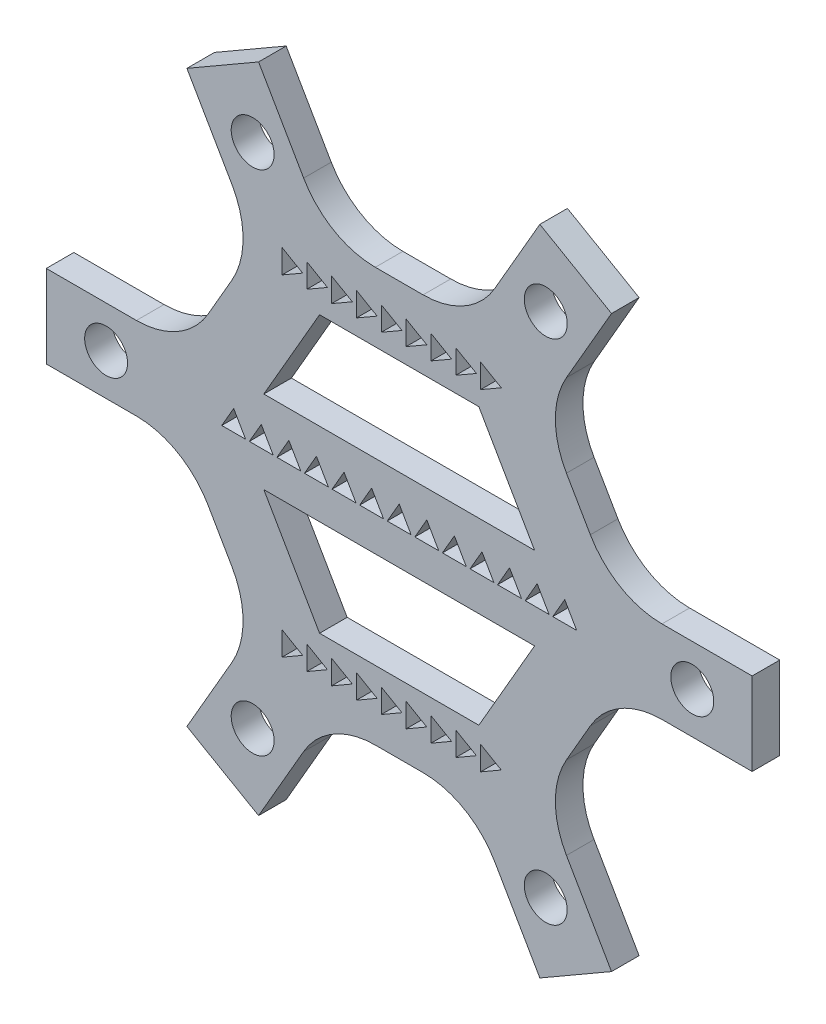
from build123d import *

# Parameters (mm, degrees)
BOSS_EXTRUDE2_DEPTH = 10
SKETCH2_R           = 8
CUT_EXTRUDE1_DEPTH  = 17
CUT_EXTRUDE2_DEPTH  = 20
SKETCH4_R           = 8
SKETCH4_R_2         = 2.8
BOSS_EXTRUDE3_DEPTH = 10
SKETCH5_R           = 7.78
CUT_EXTRUDE3_DEPTH  = 19


with BuildPart() as part:
    # Sketch1 → Boss-Extrude2 (new body)
    # profile 1 of 2: a face of its own
    with BuildSketch(Plane.XY):
        with BuildLine():
            ThreePointArc((-60.621778265, 45), (-56.602540378, 60), (-60.621778265, 75))
            Line((-60.621778265, 75), (-76.961524227, 103.301270189))
            Line((-76.961524227, 103.301270189), (-50.980762114, 118.301270189))
            Line((-50.980762114, 118.301270189), (-34.641016151, 90))
            ThreePointArc((-34.641016151, 90), (-23.660254038, 79.019237886), (-8.660254038, 75))
            Line((-8.660254038, 75), (8.660254038, 75))
            ThreePointArc((8.660254038, 75), (23.660254038, 79.019237886), (34.641016151, 90))
            Line((34.641016151, 90), (50.980762114, 118.301270189))
            Line((50.980762114, 118.301270189), (76.961524227, 103.301270189))
            Line((76.961524227, 103.301270189), (60.621778265, 75))
            ThreePointArc((60.621778265, 75), (56.602540378, 60), (60.621778265, 45))
            Line((60.621778265, 45), (69.282032303, 30))
            ThreePointArc((69.282032303, 30), (80.262794416, 19.019237886), (95.262794416, 15))
            Line((95.262794416, 15), (127.942286341, 15))
            Line((127.942286341, 15), (127.942286341, -15))
            Line((127.942286341, -15), (95.262794416, -15))
            ThreePointArc((95.262794416, -15), (80.262794416, -19.019237886), (69.282032303, -30))
            Line((69.282032303, -30), (60.621778265, -45))
            ThreePointArc((60.621778265, -45), (56.602540378, -60), (60.621778265, -75))
            Line((60.621778265, -75), (76.961524227, -103.301270189))
            Line((76.961524227, -103.301270189), (50.980762114, -118.301270189))
            Line((50.980762114, -118.301270189), (34.641016151, -90))
            ThreePointArc((34.641016151, -90), (23.660254038, -79.019237886), (8.660254038, -75))
            Line((8.660254038, -75), (-8.660254038, -75))
            ThreePointArc((-8.660254038, -75), (-23.660254038, -79.019237886), (-34.641016151, -90))
            Line((-34.641016151, -90), (-50.980762114, -118.301270189))
            Line((-50.980762114, -118.301270189), (-76.961524227, -103.301270189))
            Line((-76.961524227, -103.301270189), (-60.621778265, -75))
            ThreePointArc((-60.621778265, -75), (-56.602540378, -60), (-60.621778265, -45))
            Line((-60.621778265, -45), (-69.282032303, -30))
            ThreePointArc((-69.282032303, -30), (-80.262794416, -19.019237886), (-95.262794416, -15))
            Line((-95.262794416, -15), (-127.942286341, -15))
            Line((-127.942286341, -15), (-127.942286341, 15))
            Line((-127.942286341, 15), (-95.262794416, 15))
            ThreePointArc((-95.262794416, 15), (-80.262794416, 19.019237886), (-69.282032303, 30))
            Line((-69.282032303, 30), (-60.621778265, 45))
        make_face()
        Polygon((28.867513459, -50), (57.735026919, 0), (28.867513459, 50), (-28.867513459, 50), (-57.735026919, 0), (-28.867513459, -50), align=None, mode=Mode.SUBTRACT)
    # profile 2 of 2: a face of its own
    with BuildSketch(Plane.XY):
        Polygon((49.074772881, 15), (-49.074772881, 15), (-57.735026919, 0), (-49.074772881, -15), (49.074772881, -15), (57.735026919, 0), align=None)
    extrude(amount=BOSS_EXTRUDE2_DEPTH)

    # Sketch2 → Cut-Extrude1 (cut)
    with BuildSketch(Plane.XY):
        with Locations((106.241169623, 0)):
            Circle(SKETCH2_R)
        with Locations((53.120584811, -92.007551821)):
            Circle(SKETCH2_R)
        with Locations((-53.120584811, -92.007551821)):
            Circle(SKETCH2_R)
        with Locations((-106.241169623, 0)):
            Circle(SKETCH2_R)
        with Locations((-53.120584811, 92.007551821)):
            Circle(SKETCH2_R)
        with Locations((53.120584811, 92.007551821)):
            Circle(SKETCH2_R)
    extrude(amount=CUT_EXTRUDE1_DEPTH, mode=Mode.SUBTRACT)

    # Sketch3 → Cut-Extrude2 (cut)
    with BuildSketch(Plane.XY):
        Polygon((-45.669872981, -2.5), (-50, 5), (-54.330127019, -2.5), align=None)
        Polygon((-55.669872981, -2.5), (-60, 5), (-64.330127019, -2.5), align=None)
        Polygon((-35.669872981, -2.5), (-40, 5), (-44.330127019, -2.5), align=None)
        Polygon((-25.669872981, -2.5), (-30, 5), (-34.330127019, -2.5), align=None)
        Polygon((-15.669872981, -2.5), (-20, 5), (-24.330127019, -2.5), align=None)
        Polygon((-5.669872981, -2.5), (-10, 5), (-14.330127019, -2.5), align=None)
        Polygon((4.330127019, -2.5), (0, 5), (-4.330127019, -2.5), align=None)
        Polygon((14.330127019, -2.5), (10, 5), (5.669872981, -2.5), align=None)
        Polygon((24.330127019, -2.5), (20, 5), (15.669872981, -2.5), align=None)
        Polygon((34.330127019, -2.5), (30, 5), (25.669872981, -2.5), align=None)
        Polygon((44.330127019, -2.5), (40, 5), (35.669872981, -2.5), align=None)
        Polygon((54.330127019, -2.5), (50, 5), (45.669872981, -2.5), align=None)
        Polygon((64.330127019, -2.5), (60, 5), (55.669872981, -2.5), align=None)
        Polygon((-26, 60), (-33.5, 64.330127019), (-33.5, 55.669872981), align=None)
        Polygon((-35, 60), (-42.5, 64.330127019), (-42.5, 55.669872981), align=None)
        Polygon((-17, 60), (-24.5, 64.330127019), (-24.5, 55.669872981), align=None)
        Polygon((-8, 60), (-15.5, 64.330127019), (-15.5, 55.669872981), align=None)
        Polygon((1, 60), (-6.5, 64.330127019), (-6.5, 55.669872981), align=None)
        Polygon((10, 60), (2.5, 64.330127019), (2.5, 55.669872981), align=None)
        Polygon((19, 60), (11.5, 64.330127019), (11.5, 55.669872981), align=None)
        Polygon((28, 60), (20.5, 64.330127019), (20.5, 55.669872981), align=None)
        Polygon((37, 60), (29.5, 64.330127019), (29.5, 55.669872981), align=None)
        Polygon((29.5, -55.669872981), (37, -60), (29.5, -64.330127019), align=None)
        Polygon((20.5, -55.669872981), (28, -60), (20.5, -64.330127019), align=None)
        Polygon((11.5, -55.669872981), (19, -60), (11.5, -64.330127019), align=None)
        Polygon((2.5, -55.669872981), (10, -60), (2.5, -64.330127019), align=None)
        Polygon((-6.5, -55.669872981), (1, -60), (-6.5, -64.330127019), align=None)
        Polygon((-15.5, -55.669872981), (-8, -60), (-15.5, -64.330127019), align=None)
        Polygon((-24.5, -55.669872981), (-17, -60), (-24.5, -64.330127019), align=None)
        Polygon((-33.5, -55.669872981), (-26, -60), (-33.5, -64.330127019), align=None)
        Polygon((-42.5, -55.669872981), (-35, -60), (-42.5, -64.330127019), align=None)
    extrude(amount=CUT_EXTRUDE2_DEPTH, mode=Mode.SUBTRACT)

    # Sketch4 → Boss-Extrude3 (add)
    # profile 1 of 6: a face of its own
    with BuildSketch(Plane.XY):
        with Locations((106.241169623, 0)):
            Circle(SKETCH4_R)
        with Locations((106.241169623, 0)):
            Circle(SKETCH4_R_2, mode=Mode.SUBTRACT)
    # profile 2 of 6: a face of its own
    with BuildSketch(Plane.XY):
        with Locations((53.120584811, -92.007551821)):
            Circle(SKETCH4_R)
        with Locations((53.120584811, -92.007551821)):
            Circle(SKETCH4_R_2, mode=Mode.SUBTRACT)
    # profile 3 of 6: a face of its own
    with BuildSketch(Plane.XY):
        with Locations((-53.120584811, -92.007551821)):
            Circle(SKETCH4_R)
        with Locations((-53.120584811, -92.007551821)):
            Circle(SKETCH4_R_2, mode=Mode.SUBTRACT)
    # profile 4 of 6: a face of its own
    with BuildSketch(Plane.XY):
        with Locations((-106.241169623, 0)):
            Circle(SKETCH4_R)
        with Locations((-106.241169623, 0)):
            Circle(SKETCH4_R_2, mode=Mode.SUBTRACT)
    # profile 5 of 6: a face of its own
    with BuildSketch(Plane.XY):
        with Locations((-53.120584811, 92.007551821)):
            Circle(SKETCH4_R)
        with Locations((-53.120584811, 92.007551821)):
            Circle(SKETCH4_R_2, mode=Mode.SUBTRACT)
    # profile 6 of 6: a face of its own
    with BuildSketch(Plane.XY):
        with Locations((53.120584811, 92.007551821)):
            Circle(SKETCH4_R)
        with Locations((53.120584811, 92.007551821)):
            Circle(SKETCH4_R_2, mode=Mode.SUBTRACT)
    extrude(amount=BOSS_EXTRUDE3_DEPTH)

    # Sketch5 → Cut-Extrude3 (cut)
    with BuildSketch(Plane.XY):
        with Locations((106.241169623, 0)):
            Circle(SKETCH5_R)
        with Locations((53.120584811, -92.007551821)):
            Circle(SKETCH5_R)
        with Locations((-53.120584811, -92.007551821)):
            Circle(SKETCH5_R)
        with Locations((-106.241169623, 0)):
            Circle(SKETCH5_R)
        with Locations((-53.120584811, 92.007551821)):
            Circle(SKETCH5_R)
        with Locations((53.120584811, 92.007551821)):
            Circle(SKETCH5_R)
    extrude(amount=CUT_EXTRUDE3_DEPTH, mode=Mode.SUBTRACT)


solid = part.part
